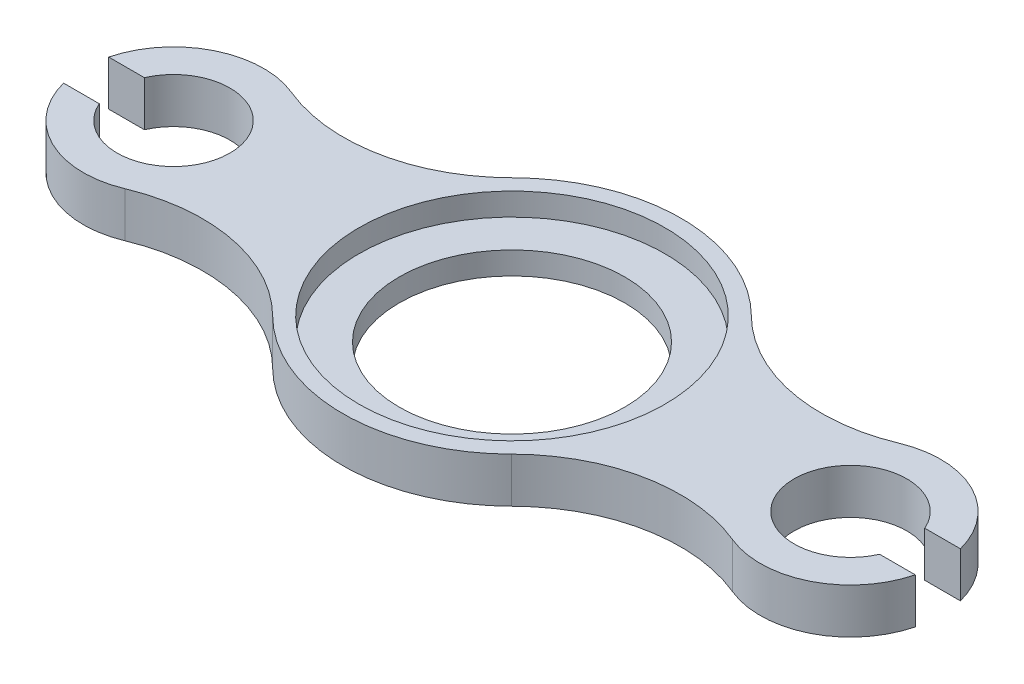
from build123d import *

# Parameters (mm, degrees)
BOSS_EXTRU_1_DEPTH      = 20
ESQUISSE2_R             = 50
ENL_V_MAT_EXTRU_1_DEPTH = 206.243757518
ESQUISSE3_R             = 67.8
ENL_V_MAT_EXTRU_2_DEPTH = 10
ESQUISSE4_R             = 25
ENL_V_MAT_EXTRU_4_DEPTH = 206.243757518
ENL_V_MAT_EXTRU_6_DEPTH = 206.243757518


with BuildPart() as part:
    # Esquisse1 → Boss.-Extru.1 (new body)
    with BuildSketch(Plane(origin=(0, 0, 0), x_dir=(1, 0, 0), z_dir=(0, 1, 0))):
        with BuildLine():
            ThreePointArc((-52.958333333, -53.107578843), (0, -75), (52.958333333, -53.107578843))
            ThreePointArc((52.958333333, -53.107578843), (91.362529225, -32.640861336), (134.666666667, -36.944402673))
            ThreePointArc((134.666666667, -36.944402673), (190, 0), (134.666666667, 36.944402673))
            ThreePointArc((134.666666667, 36.944402673), (91.362529225, 32.640861336), (52.958333333, 53.107578843))
            ThreePointArc((52.958333333, 53.107578843), (0, 75), (-52.958333333, 53.107578843))
            ThreePointArc((-52.958333333, 53.107578843), (-91.362529225, 32.640861336), (-134.666666667, 36.944402673))
            ThreePointArc((-134.666666667, 36.944402673), (-190, 0), (-134.666666667, -36.944402673))
            ThreePointArc((-134.666666667, -36.944402673), (-91.362529225, -32.640861336), (-52.958333333, -53.107578843))
        make_face()
    extrude(amount=BOSS_EXTRU_1_DEPTH)

    # Esquisse2 → Enlèv. mat.-Extru.1 (cut, through all)
    with BuildSketch(Plane(origin=(0, 20, 0), x_dir=(1, 0, 0), z_dir=(0, 1, 0))):
        with Locations(Location((0, 0, 0), (0, 0, 270))):
            Circle(ESQUISSE2_R)
    extrude(amount=-ENL_V_MAT_EXTRU_1_DEPTH, mode=Mode.SUBTRACT)

    # Esquisse3 → Enlèv. mat.-Extru.2 (cut)
    with BuildSketch(Plane(origin=(0, 20, 0), x_dir=(1, 0, 0), z_dir=(0, 1, 0))):
        with Locations(Location((0, 0, 0), (0, 0, 270))):
            Circle(ESQUISSE3_R)
    extrude(amount=-ENL_V_MAT_EXTRU_2_DEPTH, mode=Mode.SUBTRACT)

    # Esquisse4 → Enlèv. mat.-Extru.4 (cut, through all)
    with BuildSketch(Plane(origin=(0, 20, 0), x_dir=(1, 0, 0), z_dir=(0, 1, 0))):
        with Locations(Location((-150, 0, 0), (0, 0, 270))):
            Circle(ESQUISSE4_R)
        with Locations(Location((150, 0, 0), (0, 0, 90))):
            Circle(ESQUISSE4_R)
    extrude(amount=-ENL_V_MAT_EXTRU_4_DEPTH, mode=Mode.SUBTRACT)

    # Esquisse5 → Enlèv. mat.-Extru.6 (cut, through all)
    with BuildSketch(Plane(origin=(0, 20, 0), x_dir=(1, 0, 0), z_dir=(0, 1, 0))):
        with BuildLine():
            Line((-188.729833462, -10), (-172.912878475, -10))
            ThreePointArc((-172.912878475, -10), (-175, 0), (-172.912878475, 10))
            Line((-172.912878475, 10), (-188.729833462, 10))
            ThreePointArc((-188.729833462, 10), (-190, 0), (-188.729833462, -10))
        make_face()
        with BuildLine():
            Line((188.729833462, -10), (172.912878475, -10))
            ThreePointArc((172.912878475, -10), (175, 0), (172.912878475, 10))
            Line((172.912878475, 10), (188.729833462, 10))
            ThreePointArc((188.729833462, 10), (190, 0), (188.729833462, -10))
        make_face()
    extrude(amount=-ENL_V_MAT_EXTRU_6_DEPTH, mode=Mode.SUBTRACT)


solid = part.part
